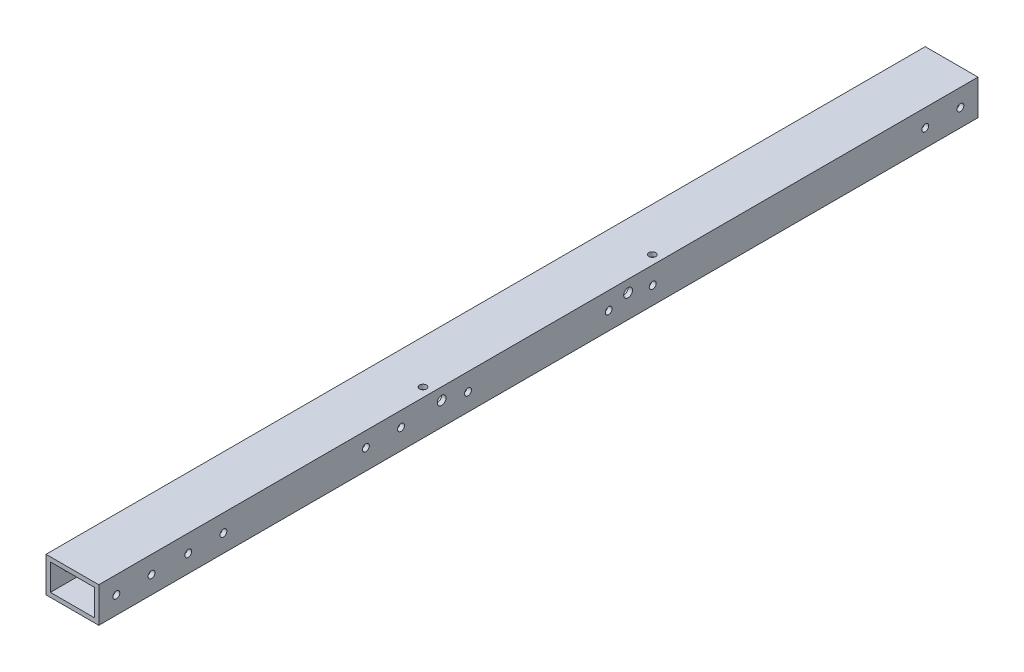
from build123d import *

# Parameters (mm, degrees)
BOSS_EXTRUDE1_DEPTH         = 317.499999
BOSS_EXTRUDE1_DEPTH_BACK    = 317.499999
SKETCH3_W                   = 38.1
SKETCH3_H                   = 25.4
SKETCH3_W_2                 = 31.75
SKETCH3_H_2                 = 19.05
F_10_CLEARANCE_HOLE2_D      = 4.9784
F_10_CLEARANCE_HOLE4_D      = 4.9784
F_10_CLEARANCE_HOLE3_D      = 4.9784
F_10_CLEARANCE_HOLE5_D      = 4.9784
F_10_CLEARANCE_HOLE6_D      = 4.9784
F_1_4_0_25_DIAMETER_HOLE1_D = 6.35


with BuildPart() as part:
    # Sketch3 → Boss-Extrude1 (new, two sides: drawn at the far end of the back side and taken through both)
    with BuildSketch(Plane.XY.offset(-BOSS_EXTRUDE1_DEPTH_BACK)):
        Rectangle(SKETCH3_W, SKETCH3_H)
        Rectangle(SKETCH3_W_2, SKETCH3_H_2, mode=Mode.SUBTRACT)
    extrude(amount=BOSS_EXTRUDE1_DEPTH + BOSS_EXTRUDE1_DEPTH_BACK)

    # #10 Clearance Hole2 (through all)
    with Locations(Plane.ZY.offset(19.05)):
        with Locations((-304.800000508, 0), (-279.400000508, 0), (279.399999492, 0), (304.799999492, 0)):
            Hole(F_10_CLEARANCE_HOLE2_D / 2)

    # #10 Clearance Hole4 (through all)
    with Locations(Plane(origin=(19.05, 0, 0), x_dir=(0, 0, -1), z_dir=(1, 0, 0))):
        with Locations((-252.857000506, 8e-09), (-227.457000506, 1.1e-08), (-124.587000507, 1.943404818), (-99.187000507, 1.943404821)):
            Hole(F_10_CLEARANCE_HOLE4_D / 2)

    # #10 Clearance Hole3 (through all)
    with Locations(Plane.ZY.offset(19.05)):
        with Locations((-50.8, 0), (50.8, 0)):
            Hole(F_10_CLEARANCE_HOLE3_D / 2)

    # #10 Clearance Hole5 (through all)
    with Locations(Plane(origin=(19.05, 0, 0), x_dir=(0, 0, -1), z_dir=(1, 0, 0))):
        with Locations((82.55, 0)):
            Hole(F_10_CLEARANCE_HOLE5_D / 2)

    # #10 Clearance Hole6 (through all)
    with Locations(Plane(origin=(0, -12.7, 0), x_dir=(-1, 0, 0), z_dir=(0, -1, 0))):
        with Locations((-12.466755932, -76.754257499), (-12.466755932, 88.899999492)):
            Hole(F_10_CLEARANCE_HOLE6_D / 2)

    # 1/4 (0.25) Diameter Hole1 (through all)
    with Locations(Plane.ZY.offset(19.05)):
        with Locations((69.85, 4.2), (-64.797229307, 4.2)):
            Hole(F_1_4_0_25_DIAMETER_HOLE1_D / 2)


solid = part.part
